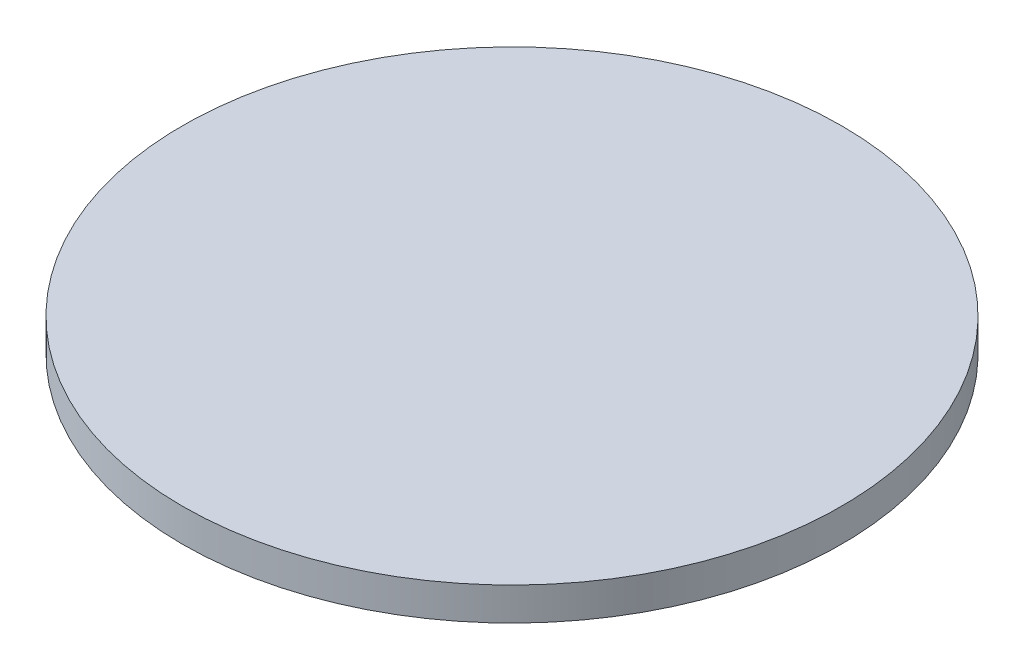
from build123d import *

# Parameters (mm, degrees)
SKETCH1_R                     = 30
KOLA330_ALT_BILEZIK_D60_DEPTH = 3


with BuildPart() as part:
    # Sketch1 → KOLA330_alt_bilezik_D60 (new body)
    with BuildSketch(Plane(origin=(0, 0, 0), x_dir=(1, 0, 0), z_dir=(0, 1, 0))):
        with Locations(Location((0, 0, 0), (0, 0, 270))):
            Circle(SKETCH1_R)
    extrude(amount=KOLA330_ALT_BILEZIK_D60_DEPTH)


solid = part.part
